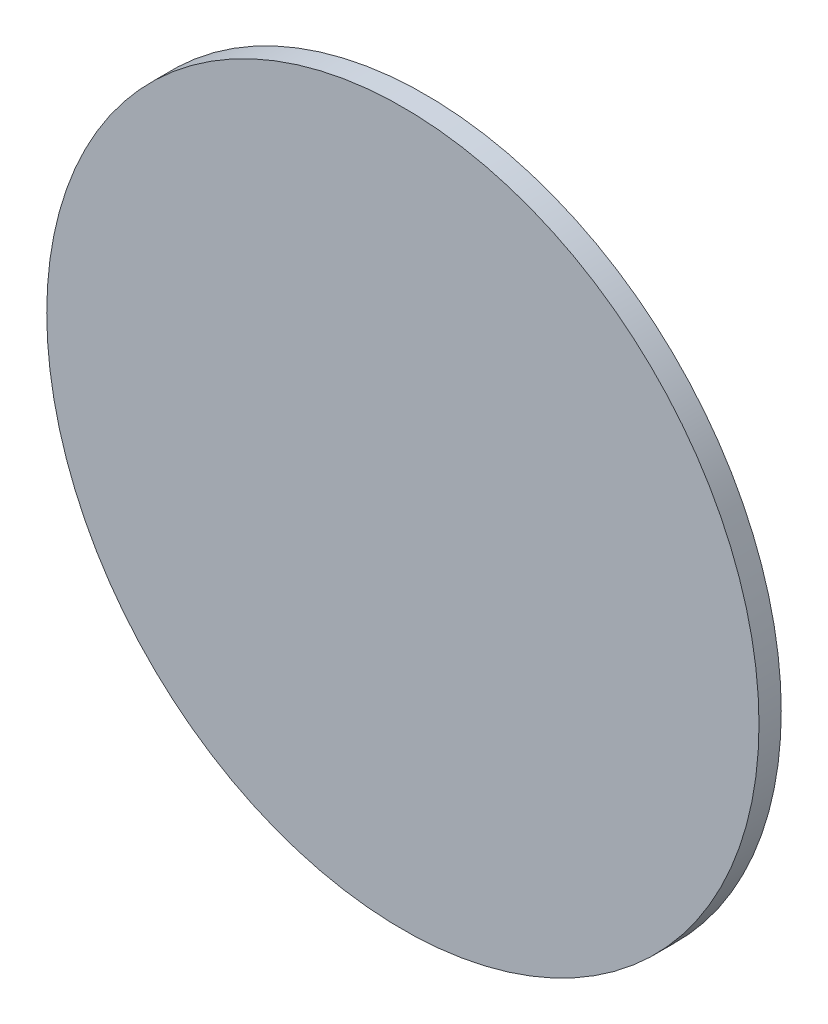
from build123d import *

# Parameters (mm, degrees)
SKETCH1_R           = 160
BOSS_EXTRUDE1_DEPTH = 10


with BuildPart() as part:
    # Sketch1 → Boss-Extrude1 (new body)
    with BuildSketch(Plane.XY):
        Circle(SKETCH1_R)
    extrude(amount=BOSS_EXTRUDE1_DEPTH)


solid = part.part
